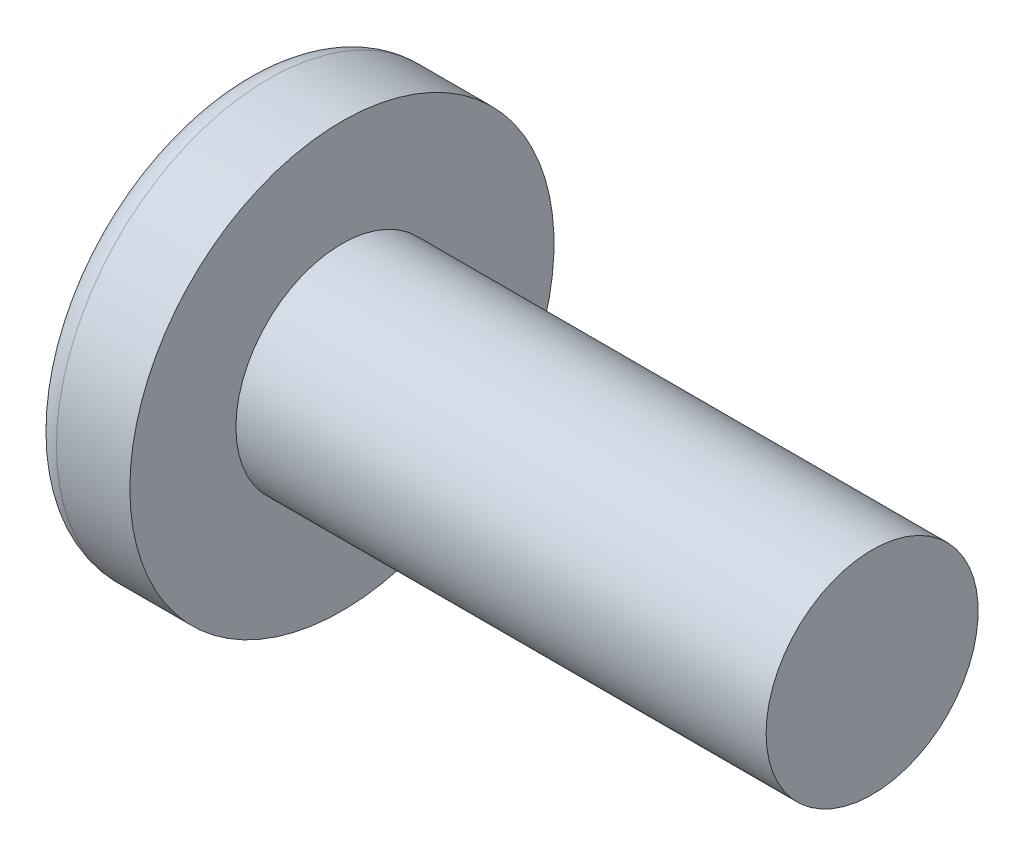
from build123d import *

# Parameters (mm, degrees)
CIRPATTERN1_COUNT = 2
CIRPATTERN1_ANGLE = 90


with BuildPart() as part:
    # BodySke → Base-Revolve (revolve)
    with BuildSketch(Plane.XY, mode=Mode.PRIVATE) as base_revolve_sk:
        with BuildLine():
            Line((6, 4), (6, 8))
            Line((6, 8), (3.232707642, 8))
            ThreePointArc((3.232707642, 8), (2.795258072, 7.894539568), (2.453920212, 7.601328904))
            ThreePointArc((2.453920212, 7.601328904), (0.628681613, 3.993805375), (0, 0))
            Line((0, 0), (26, 0))
            Line((26, 0), (26, 4))
            Line((26, 4), (6, 4))
        make_face()
    revolve(base_revolve_sk.sketch.rotate(Axis((-25.4, 0, 0), (1, 0, 0)), 90), axis=Axis((-25.4, 0, 0), (1, 0, 0)))

    # Sketch3 → Cut-Loft1 section 0
    with BuildSketch(Plane(origin=(0, 0, 0), x_dir=(0, 0, -1), z_dir=(1, 0, 0))):
        with BuildLine():
            Line((0.845, -4.51), (-0.845, -4.51))
            Line((-0.845, -4.51), (-0.845, 4.51))
            Line((-0.845, 4.51), (0.845, 4.51))
            Line((0.845, 4.51), (0.845, -4.51))
        make_face()
    # Sketch4 → Cut-Loft1 section 1
    with BuildSketch(Plane(origin=(4.88, 0, 0), x_dir=(0, 0, -1), z_dir=(1, 0, 0))):
        with BuildLine():
            Line((0.4225, -0.4225), (-0.4225, -0.4225))
            Line((-0.4225, -0.4225), (-0.4225, 0.4225))
            Line((-0.4225, 0.4225), (0.4225, 0.4225))
            Line((0.4225, 0.4225), (0.4225, -0.4225))
        make_face()
    cut_loft1 = loft(mode=Mode.SUBTRACT)

    # CirPattern1: Cut-Loft1 ×2 about axis
    cirpattern1_axis = Axis((0, 0, 0), (1, 0, 0))
    for i in range(1, CIRPATTERN1_COUNT):
        add(cut_loft1.rotate(cirpattern1_axis, i * CIRPATTERN1_ANGLE / (CIRPATTERN1_COUNT - 1)), mode=Mode.SUBTRACT)


solid = part.part
